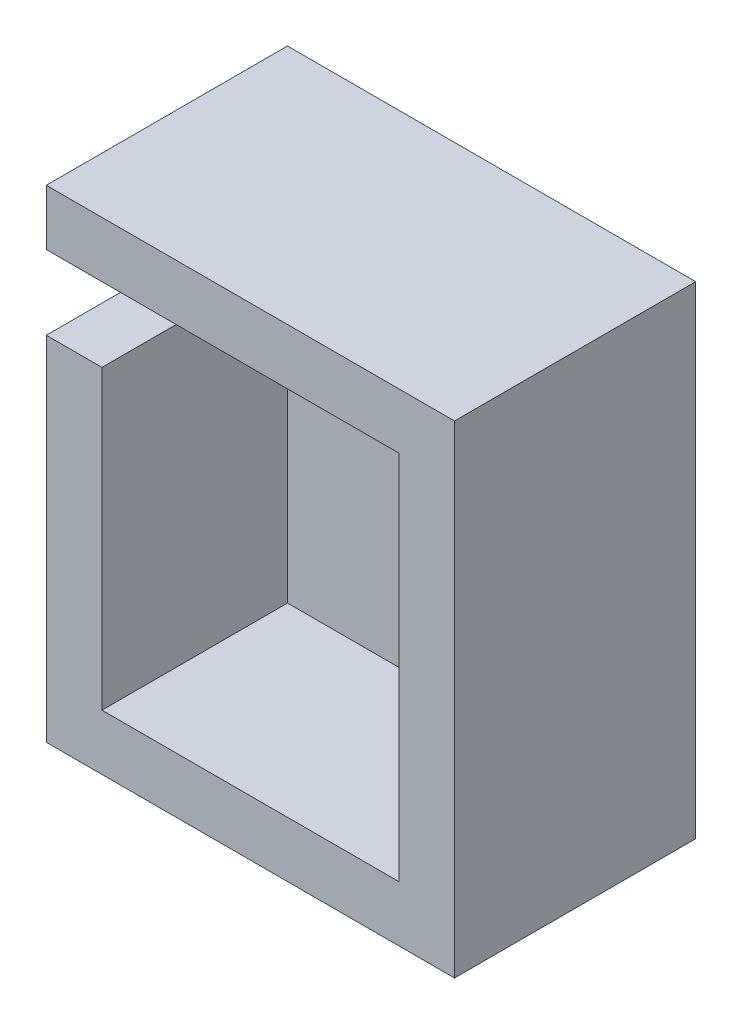
from build123d import *

# Parameters (mm, degrees)
BOSS_EXTRUDE1_DEPTH = 10
SKETCH2_W           = 22
SKETCH2_H           = 26
BOSS_EXTRUDE2_DEPTH = 3


with BuildPart() as part:
    # Sketch1 → Boss-Extrude1 (new body)
    with BuildSketch(Plane.XY):
        Polygon((-72.1, 8.9), (-53.1, 8.9), (-53.1, -11.1), (-69.1, -11.1), (-69.1, 4.9), (-72.1, 4.9), (-72.1, -14.1), (-50.1, -14.1), (-50.1, 11.9), (-72.1, 11.9), align=None)
    extrude(amount=BOSS_EXTRUDE1_DEPTH)

    # Sketch2 → Boss-Extrude2 (add)
    with BuildSketch(Plane(origin=(0, 0, 0), x_dir=(-1, 0, 0), z_dir=(0, 0, -1))):
        with Locations((61.1, -1.1)):
            Rectangle(SKETCH2_W, SKETCH2_H)
    extrude(amount=BOSS_EXTRUDE2_DEPTH)


solid = part.part
